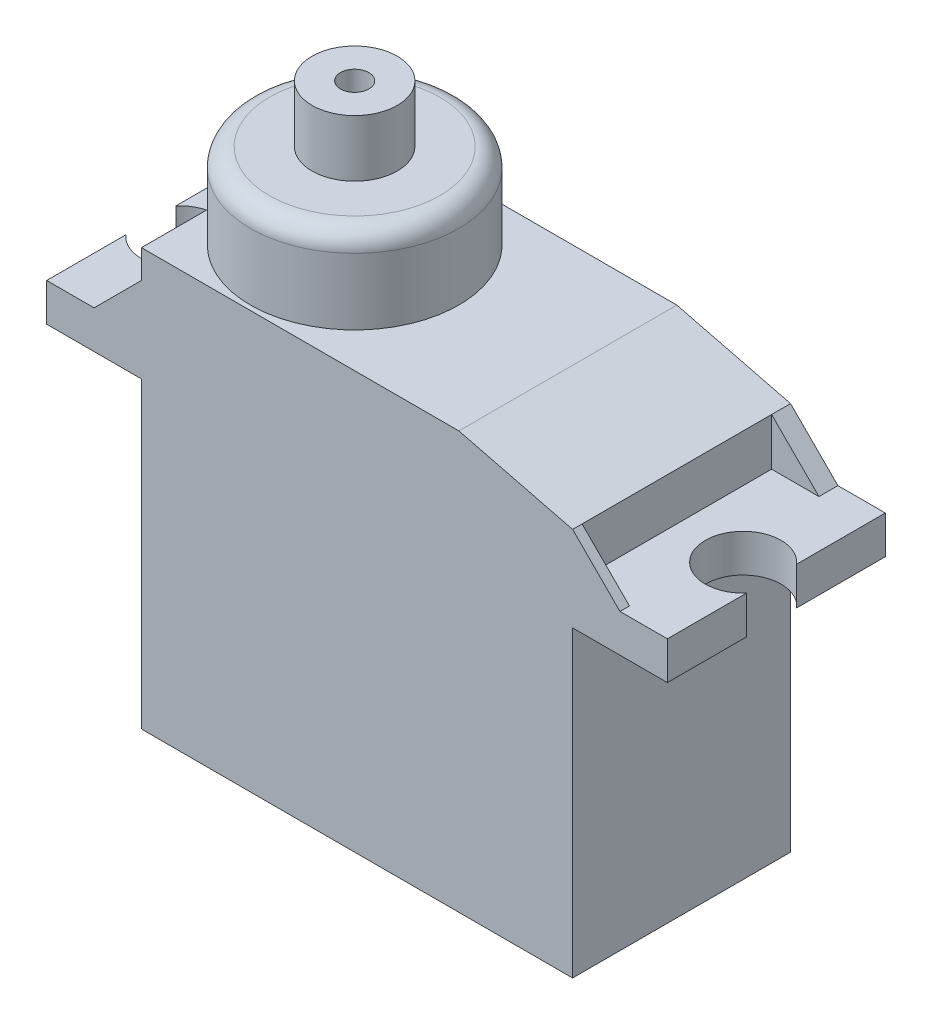
from build123d import *

# Parameters (mm, degrees)
SKETCH1_W           = 22.75
SKETCH1_H           = 11.5
BOSS_EXTRUDE1_DEPTH = 16
BOSS_EXTRUDE2_DEPTH = 11.5
SKETCH3_R           = 5.5
BOSS_EXTRUDE3_DEPTH = 4.5
FILLET1_R           = 1
SKETCH5_R           = 2.25
BOSS_EXTRUDE5_DEPTH = 3
SKETCH6_R           = 0.75
CUT_EXTRUDE1_DEPTH  = 5
CUT_EXTRUDE2_START  = -0.5
CUT_EXTRUDE2_DEPTH  = 10
SKETCH7_R           = 2
CUT_EXTRUDE3_DEPTH  = 36.01874498


with BuildPart() as part:
    # Sketch1 → Boss-Extrude1 (new body)
    with BuildSketch(Plane(origin=(0, 0, 0), x_dir=(1, 0, 0), z_dir=(0, 1, 0))):
        with Locations((11.375, 5.75)):
            Rectangle(SKETCH1_W, SKETCH1_H)
    extrude(amount=BOSS_EXTRUDE1_DEPTH)

    # Sketch2 → Boss-Extrude2 (add)
    with BuildSketch(Plane.XY):
        Polygon((22.75, 16), (27.75, 16), (27.75, 18), (25.25, 18), (22.75, 20.5), (16.75, 22), (0, 22), (0, 20.5), (-2.5, 18), (-5, 18), (-5, 16), (0, 16), align=None)
    extrude(amount=-BOSS_EXTRUDE2_DEPTH)

    # Sketch3 → Boss-Extrude3 (add)
    with BuildSketch(Plane(origin=(0, 22, 0), x_dir=(1, 0, 0), z_dir=(0, 1, 0))):
        with Locations(Location((5.5, 5.75, 0), (0, 0, 180))):
            Circle(SKETCH3_R)
    extrude(amount=BOSS_EXTRUDE3_DEPTH)

    # Fillet1
    fillet1_edges = [part.edges().sort_by_distance(p)[0] for p in [
        (11, 26.5, -5.75),
    ]]
    fillet(fillet1_edges, radius=FILLET1_R)

    # Sketch5 → Boss-Extrude5 (add)
    with BuildSketch(Plane(origin=(0, 26.5, 0), x_dir=(1, 0, 0), z_dir=(0, 1, 0))):
        with Locations(Location((5.5, 5.75, 0), (0, 0, 180))):
            Circle(SKETCH5_R)
    extrude(amount=BOSS_EXTRUDE5_DEPTH)

    # Sketch6 → Cut-Extrude1 (cut)
    with BuildSketch(Plane(origin=(0, 29.5, 0), x_dir=(1, 0, 0), z_dir=(0, 1, 0))):
        with Locations(Location((5.5, 5.75, 0), (0, 0, 180))):
            Circle(SKETCH6_R)
    extrude(amount=-CUT_EXTRUDE1_DEPTH, mode=Mode.SUBTRACT)

    # Sketch8 → Cut-Extrude2 (cut)
    with BuildSketch(Plane.XY.offset(CUT_EXTRUDE2_START)):
        Polygon((-2.5, 18), (0, 18), (0, 20.5), align=None)
        Polygon((22.75, 20.5), (22.75, 18), (25.25, 18), align=None)
    extrude(amount=-CUT_EXTRUDE2_DEPTH, mode=Mode.SUBTRACT)

    # Sketch7 → Cut-Extrude3 (cut, through all)
    with BuildSketch(Plane(origin=(0, 18, 0), x_dir=(1, 0, 0), z_dir=(0, 1, 0))):
        with Locations((26.25, 5.5)):
            Circle(SKETCH7_R)
        with Locations((-3.5, 5.5)):
            Circle(SKETCH7_R)
    extrude(amount=-CUT_EXTRUDE3_DEPTH, mode=Mode.SUBTRACT)


solid = part.part
